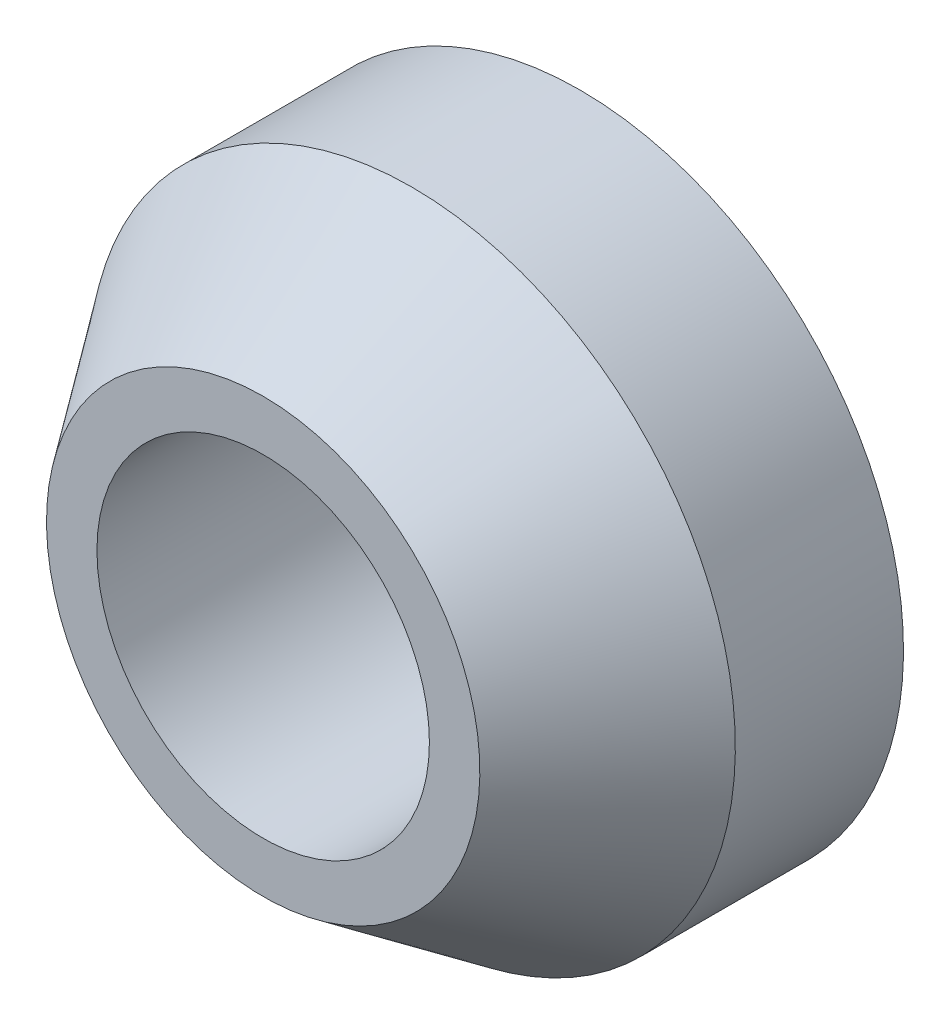
from build123d import *

# Parameters (mm, degrees)
F_1_4_CLEARANCE_HOLE1_D = 6.5278
SKETCH4_W               = 12.7
SKETCH4_H               = 12.7
CUT_EXTRUDE1_DEPTH      = 0.127


with BuildPart() as part:
    # Sketch1 → Revolve1 (revolve)
    with BuildSketch(Plane(origin=(0, 0, 0), x_dir=(0, 0, -1), z_dir=(1, 0, 0))):
        Polygon((-6.35, 0), (-6.35, 4.2545), (-3.429, 6.35), (0, 6.35), (0, 0), align=None)
    revolve(axis=Axis((0, 0, 0), (0, 0, 1)))

    # 1/4 Clearance Hole1 (through all)
    with Locations(Plane.XY.offset(6.35)):
        with Locations((0, 0)):
            Hole(F_1_4_CLEARANCE_HOLE1_D / 2)

    # Sketch4 → Cut-Extrude1 (cut)
    with BuildSketch(Plane(origin=(0, 0, 0), x_dir=(-1, 0, 0), z_dir=(0, 0, -1))):
        Rectangle(SKETCH4_W, SKETCH4_H)
    extrude(amount=-CUT_EXTRUDE1_DEPTH, mode=Mode.SUBTRACT)


solid = part.part
